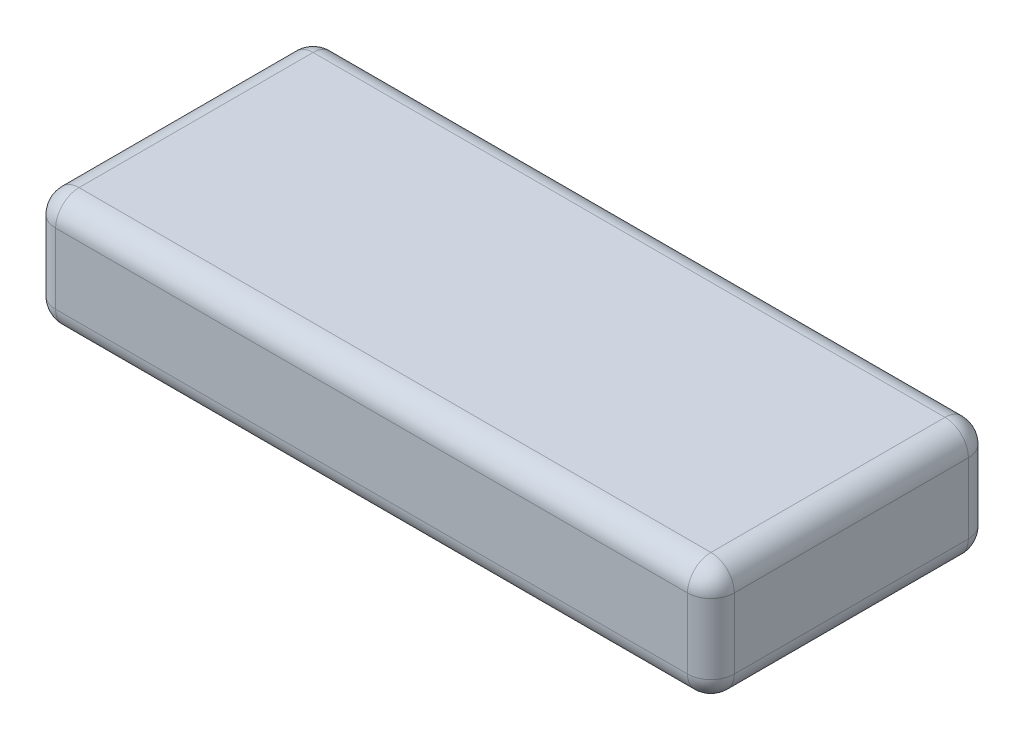
from build123d import *

# Parameters (mm, degrees)
SKETCH1_W           = 29
SKETCH1_H           = 12
BOSS_EXTRUDE1_DEPTH = 5
FILLET1_R           = 1


with BuildPart() as part:
    # Sketch1 → Boss-Extrude1 (new body)
    with BuildSketch(Plane(origin=(0, 0, 0), x_dir=(1, 0, 0), z_dir=(0, 1, 0))):
        Rectangle(SKETCH1_W, SKETCH1_H)
    extrude(amount=BOSS_EXTRUDE1_DEPTH)

    # Fillet1
    fillet1_edges = [part.edges().sort_by_distance(p)[0] for p in [
        (-14.5, 5, 0),
        (0, 5, 6),
        (14.5, 5, 0),
        (0, 0, 6),
        (-14.5, 0, 0),
        (0, 0, -6),
        (14.5, 0, 0),
        (14.5, 2.5, 6),
        (-14.5, 2.5, 6),
        (-14.5, 2.5, -6),
        (14.5, 2.5, -6),
        (0, 5, -6),
    ]]
    fillet(fillet1_edges, radius=FILLET1_R)


solid = part.part
